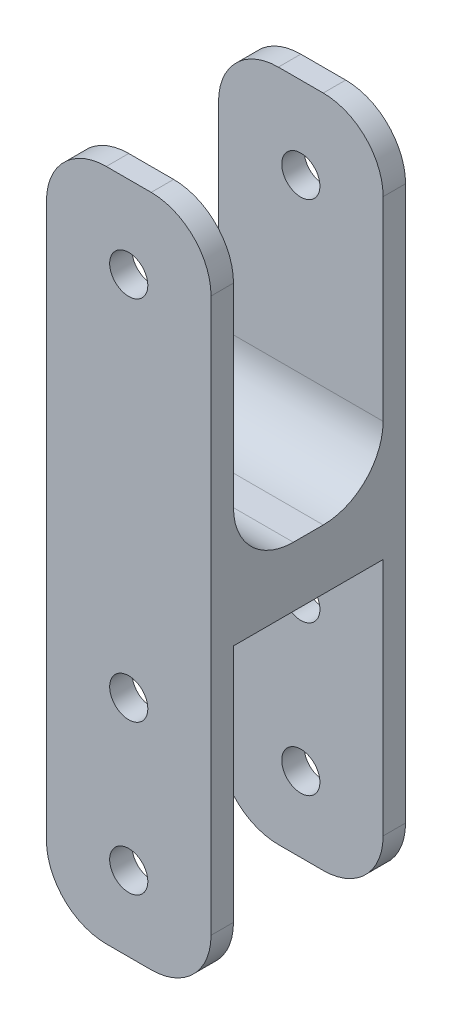
from build123d import *

# Parameters (mm, degrees)
EXTRUDE_1_DEPTH     = 22
SKETCH_2_R          = 2.55
CUT_EXTRUDE_1_DEPTH = 61.497933849
FILLET_1_R          = 8


with BuildPart() as part:
    # Эскиз1 → Бобышка-Вытянуть1 (new body)
    with BuildSketch(Plane(origin=(0, 0, 0), x_dir=(0, 0, -1), z_dir=(1, 0, 0))):
        with BuildLine():
            Line((10.206185567, 0), (10.206185567, -40))
            Line((10.206185567, -40), (13.206185567, -40))
            Line((13.206185567, -40), (13.206185567, 50))
            Line((13.206185567, 50), (10.206185567, 50))
            Line((10.206185567, 50), (10.206185567, 16))
            ThreePointArc((10.206185567, 16), (7.863039817, 10.343145751), (2.206185567, 8))
            Line((2.206185567, 8), (-1.793814433, 8))
            ThreePointArc((-1.793814433, 8), (-7.450668682, 10.343145751), (-9.793814433, 16))
            Line((-9.793814433, 16), (-9.793814433, 50))
            Line((-9.793814433, 50), (-12.793814433, 50))
            Line((-12.793814433, 50), (-12.793814433, -40))
            Line((-12.793814433, -40), (-9.793814433, -40))
            Line((-9.793814433, -40), (-9.793814433, 0))
            Line((-9.793814433, 0), (10.206185567, 0))
        make_face()
    extrude(amount=EXTRUDE_1_DEPTH)

    # Эскиз2 → Вырез-Вытянуть1 (cut, through all)
    with BuildSketch(Plane.XY.offset(12.793814433)):
        with Locations((11, -30)):
            Circle(SKETCH_2_R)
        with Locations((11, -10)):
            Circle(SKETCH_2_R)
        with Locations((11, 39)):
            Circle(SKETCH_2_R)
    extrude(amount=-CUT_EXTRUDE_1_DEPTH, mode=Mode.SUBTRACT)

    # Скругление1
    fillet_1_edges = [part.edges().sort_by_distance(p)[0] for p in [
        (22, -40, -11.706185567),
        (0, -40, 11.293814433),
        (0, 50, 11.293814433),
        (22, 50, -11.706185567),
        (0, 50, -11.706185567),
        (0, -40, -11.706185567),
        (22, 50, 11.293814433),
        (22, -40, 11.293814433),
    ]]
    fillet(fillet_1_edges, radius=FILLET_1_R)


solid = part.part
